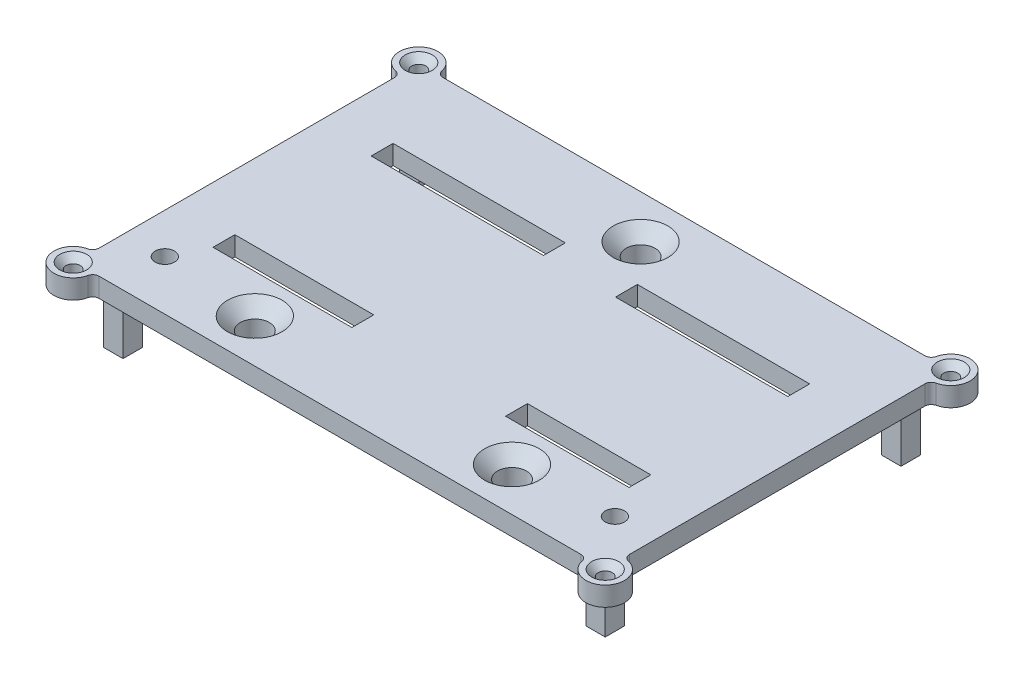
from build123d import *

# Parameters (mm, degrees)
SKETCH_2_R          = 1.1
SKETCH_2_R_2        = 2.25
SKETCH_2_W          = 25.8
SKETCH_2_H          = 2.4
SKETCH_2_W_2        = 20.6
SKETCH_2_W_3        = 18.2
EXTRUDE_1_DEPTH     = 3
CHAMFER_1_SIZE      = 1
SKETCH_3_W          = 26.8
SKETCH_3_H          = 3.4
SKETCH_3_W_2        = 19.2
SKETCH_3_W_3        = 21.6
CUT_EXTRUDE_1_DEPTH = 54.573406165
CHAMFER_2_SIZE      = 2
EXTRUDE_START       = -2.2
SKETCH_4_R          = 4
SKETCH_4_R_2        = 2.25
EXTRUDE_2_DEPTH     = 2.2
SKETCH_5_W          = 3
SKETCH_5_H          = 3
EXTRUDE_3_DEPTH     = 8.5
CHAMFER_3_SIZE      = 1
SKETCH_6_R          = 1.5
CUT_EXTRUDE_2_DEPTH = 55.160500811


with BuildPart() as part:
    # 草图2 → 凸台-拉伸1 (new body)
    with BuildSketch(Plane(origin=(0, 0, 0), x_dir=(1, 0, 0), z_dir=(0, 1, 0))):
        with BuildLine():
            Line((37.46902332, -26.75), (-37.46902332, -26.75))
            ThreePointArc((-37.46902332, -26.75), (-38.093655246, -26.969080697), (-38.444597576, -27.530330086))
            ThreePointArc((-38.444597576, -27.530330086), (-43.492640687, -28.992640687), (-42.030330086, -23.944597576))
            ThreePointArc((-42.030330086, -23.944597576), (-41.469080697, -23.593655246), (-41.25, -22.96902332))
            Line((-41.25, -22.96902332), (-41.25, 22.96902332))
            ThreePointArc((-41.25, 22.96902332), (-41.469080697, 23.593655246), (-42.030330086, 23.944597576))
            ThreePointArc((-42.030330086, 23.944597576), (-43.492640687, 28.992640687), (-38.444597576, 27.530330086))
            ThreePointArc((-38.444597576, 27.530330086), (-38.093655246, 26.969080697), (-37.46902332, 26.75))
            Line((-37.46902332, 26.75), (37.46902332, 26.75))
            ThreePointArc((37.46902332, 26.75), (38.093655246, 26.969080697), (38.444597576, 27.530330086))
            ThreePointArc((38.444597576, 27.530330086), (43.492640687, 28.992640687), (42.030330086, 23.944597576))
            ThreePointArc((42.030330086, 23.944597576), (41.469080697, 23.593655246), (41.25, 22.96902332))
            Line((41.25, 22.96902332), (41.25, -22.96902332))
            ThreePointArc((41.25, -22.96902332), (41.469080697, -23.593655246), (42.030330086, -23.944597576))
            ThreePointArc((42.030330086, -23.944597576), (43.492640687, -28.992640687), (38.444597576, -27.530330086))
            ThreePointArc((38.444597576, -27.530330086), (38.093655246, -26.969080697), (37.46902332, -26.75))
        make_face()
        with Locations(Location((-41.371320344, 26.871320344, 0), (0, 0, 270))):
            Circle(SKETCH_2_R, mode=Mode.SUBTRACT)
        with Locations(Location((-41.371320344, -26.871320344, 0), (0, 0, 270))):
            Circle(SKETCH_2_R, mode=Mode.SUBTRACT)
        with Locations(Location((41.371320344, -26.871320344, 0), (0, 0, 270))):
            Circle(SKETCH_2_R, mode=Mode.SUBTRACT)
        with Locations(Location((41.371320344, 26.871320344, 0), (0, 0, 270))):
            Circle(SKETCH_2_R, mode=Mode.SUBTRACT)
        with Locations(Location((0, 20, 0), (0, 0, 270))):
            Circle(SKETCH_2_R_2, mode=Mode.SUBTRACT)
        with Locations(Location((-20, -20, 0), (0, 0, 270))):
            Circle(SKETCH_2_R_2, mode=Mode.SUBTRACT)
        with Locations(Location((20, -20, 0), (0, 0, 270))):
            Circle(SKETCH_2_R_2, mode=Mode.SUBTRACT)
        with Locations((-19.1, 12.3)):
            Rectangle(SKETCH_2_W, SKETCH_2_H, mode=Mode.SUBTRACT)
        with Locations((18.9, 12.3)):
            Rectangle(SKETCH_2_W, SKETCH_2_H, mode=Mode.SUBTRACT)
        with Locations((-21.7, -12.3)):
            Rectangle(SKETCH_2_W_2, SKETCH_2_H, mode=Mode.SUBTRACT)
        with Locations((22.6, -12.3)):
            Rectangle(SKETCH_2_W_3, SKETCH_2_H, mode=Mode.SUBTRACT)
    extrude(amount=EXTRUDE_1_DEPTH)

    # 倒角1
    chamfer_1_edges = [part.edges().sort_by_distance(p)[0] for p in [
        (-41.371320344, 3, -27.971320344),
        (-41.371320344, 3, 25.771320344),
        (41.371320344, 3, 25.771320344),
        (41.371320344, 3, -27.971320344),
    ]]
    chamfer(chamfer_1_edges, length=CHAMFER_1_SIZE)

    # 草图3 → 切除-拉伸1 (cut, through all)
    with BuildSketch(Plane(origin=(0, 0, 0), x_dir=(1, 0, 0), z_dir=(0, 1, 0))):
        with Locations((-19.1, 12.3)):
            Rectangle(SKETCH_3_W, SKETCH_3_H)
        with Locations((18.9, 12.3)):
            Rectangle(SKETCH_3_W, SKETCH_3_H)
        with Locations((22.6, -12.3)):
            Rectangle(SKETCH_3_W_2, SKETCH_3_H)
        with Locations((-21.7, -12.3)):
            Rectangle(SKETCH_3_W_3, SKETCH_3_H)
    extrude(amount=CUT_EXTRUDE_1_DEPTH, mode=Mode.SUBTRACT)

    # 倒角2
    chamfer_2_edges = [part.edges().sort_by_distance(p)[0] for p in [
        (0, 3, -22.25),
        (-20, 3, 17.75),
        (20, 3, 17.75),
    ]]
    chamfer(chamfer_2_edges, length=CHAMFER_2_SIZE)

    # 草图4 → 凸台-拉伸2 (add)
    # profile 1 of 3: a face of its own
    with BuildSketch(Plane(origin=(0, 0, 0), x_dir=(1, 0, 0), z_dir=(0, 1, 0)).offset(EXTRUDE_START)):
        with Locations(Location((-20, -20, 0), (0, 0, 270))):
            Circle(SKETCH_4_R)
        with Locations(Location((-20, -20, 0), (0, 0, 270))):
            Circle(SKETCH_4_R_2, mode=Mode.SUBTRACT)
    # profile 2 of 3: a face of its own
    with BuildSketch(Plane(origin=(0, 0, 0), x_dir=(1, 0, 0), z_dir=(0, 1, 0)).offset(EXTRUDE_START)):
        with Locations(Location((20, -20, 0), (0, 0, 270))):
            Circle(SKETCH_4_R)
        with Locations(Location((20, -20, 0), (0, 0, 270))):
            Circle(SKETCH_4_R_2, mode=Mode.SUBTRACT)
    # profile 3 of 3: a face of its own
    with BuildSketch(Plane(origin=(0, 0, 0), x_dir=(1, 0, 0), z_dir=(0, 1, 0)).offset(EXTRUDE_START)):
        with Locations(Location((0, 20, 0), (0, 0, 270))):
            Circle(SKETCH_4_R)
        with Locations(Location((0, 20, 0), (0, 0, 270))):
            Circle(SKETCH_4_R_2, mode=Mode.SUBTRACT)
    extrude(amount=EXTRUDE_2_DEPTH)

    # 草图5 → 凸台-拉伸3 (add)
    with BuildSketch(Plane(origin=(0, 0, 0), x_dir=(1, 0, 0), z_dir=(0, 1, 0))):
        with Locations((37.5, 23)):
            Rectangle(SKETCH_5_W, SKETCH_5_H)
        with Locations((-37.5, 23)):
            Rectangle(SKETCH_5_W, SKETCH_5_H)
        with Locations((37.5, -23)):
            Rectangle(SKETCH_5_W, SKETCH_5_H)
        with Locations((-37.5, -23)):
            Rectangle(SKETCH_5_W, SKETCH_5_H)
    extrude(amount=-EXTRUDE_3_DEPTH)

    # 倒角3
    chamfer_3_edges = [part.edges().sort_by_distance(p)[0] for p in [
        (-37.5, 0, -21.5),
        (-36, 0, -23),
        (36, 0, -23),
        (37.5, 0, -21.5),
        (37.5, 0, 21.5),
        (36, 0, 23),
        (-36, 0, 23),
        (-37.5, 0, 21.5),
    ]]
    chamfer(chamfer_3_edges, length=CHAMFER_3_SIZE)

    # 草图6 → 切除-拉伸2 (cut, through all)
    with BuildSketch(Plane(origin=(0, 0, 0), x_dir=(1, 0, 0), z_dir=(0, 1, 0))):
        with Locations(Location((-35, -19, 0), (0, 0, 270))):
            Circle(SKETCH_6_R)
        with Locations(Location((35, -19, 0), (0, 0, 270))):
            Circle(SKETCH_6_R)
    extrude(amount=CUT_EXTRUDE_2_DEPTH, mode=Mode.SUBTRACT)


solid = part.part
